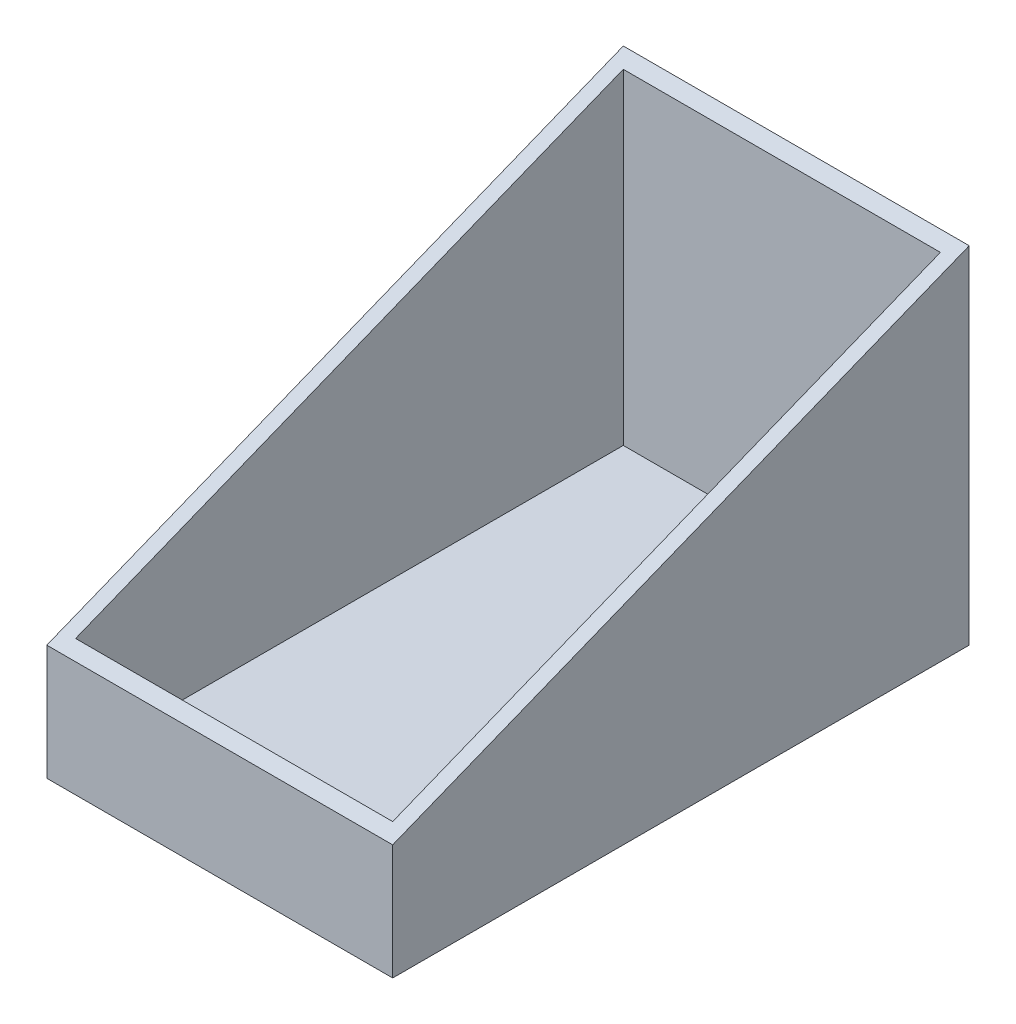
from build123d import *

# Parameters (mm, degrees)
BOSS_EXTRUDE1_DEPTH = 152.4
SHELL1_T            = -6.35


with BuildPart() as part:
    # Sketch1 → Boss-Extrude1 (new body)
    with BuildSketch(Plane(origin=(0, 0, 0), x_dir=(0, 0, -1), z_dir=(1, 0, 0))):
        Polygon((254, 0), (254, 152.4), (0, 50.8), (0, 0), align=None)
    extrude(amount=BOSS_EXTRUDE1_DEPTH)

    # Shell1
    shell1_openings = [part.faces().sort_by_distance(p)[0] for p in [
        (76.2, 101.6, -127),
    ]]
    offset(amount=SHELL1_T, openings=shell1_openings, kind=Kind.INTERSECTION)


solid = part.part
